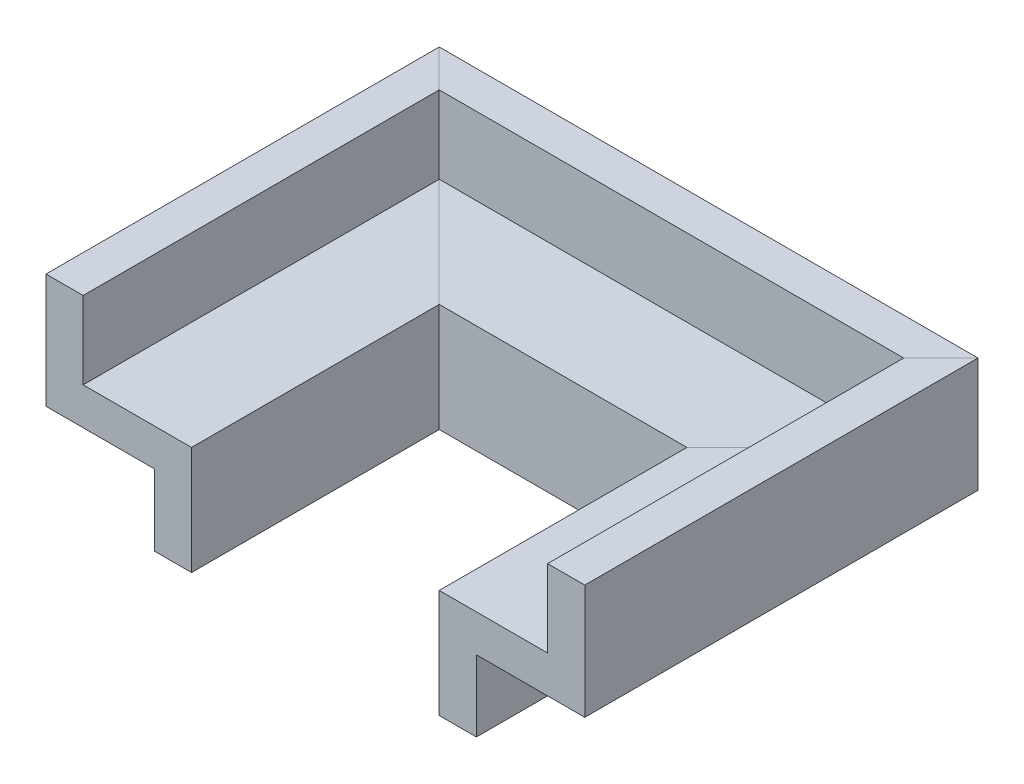
from build123d import *


with BuildPart() as part:
    # Sweep1: sweep along a path in Sketch2
    with BuildLine(Plane(origin=(0, 0, 0), x_dir=(1, 0, 0), z_dir=(0, 1, 0))) as sweep1_path:
        Line((0, 0), (0, 80))
        Line((0, 80), (80, 80))
        Line((80, 80), (80, 0))
    # Sketch1 → Sweep1 (sweep)
    with BuildSketch(Plane.XY):
        Polygon((0, 0), (0, 35), (-35, 35), (-35, 60), (-47, 60), (-47, 23), (-12, 23), (-12, 0), align=None)
    sweep(path=sweep1_path.line, transition=Transition.RIGHT)


solid = part.part
